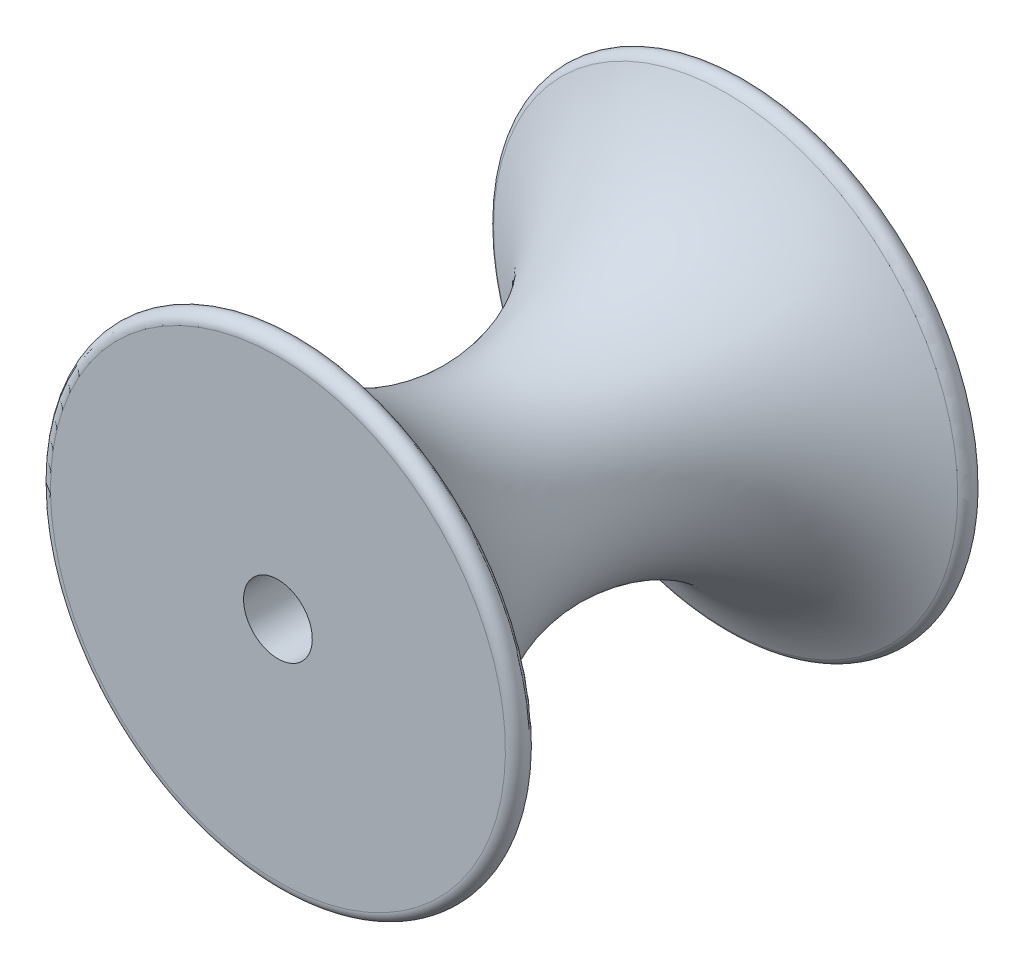
from build123d import *

# Parameters (mm, degrees)
FILLET1_R = 0.5


with BuildPart() as part:
    # Sketch1 → Revolve1 (revolve)
    with BuildSketch(Plane(origin=(0, 0, 0), x_dir=(0, 0, -1), z_dir=(1, 0, 0))):
        with BuildLine():
            Line((10.9, 1.6), (10.9, 14.020135141))
            ThreePointArc((10.9, 14.020135141), (0, 4.5), (-10.9, 14.020135141))
            Line((-10.9, 14.020135141), (-10.9, 1.6))
            Line((-10.9, 1.6), (10.9, 1.6))
        make_face()
    revolve(axis=Axis((0, 0, -11), (0, 0, 1)))

    # Fillet1
    fillet1_edges = [part.edges().sort_by_distance(p)[0] for p in [
        (0, -14.020135141, 10.9),
        (0, -14.020135141, -10.9),
    ]]
    fillet(fillet1_edges, radius=FILLET1_R)


solid = part.part
